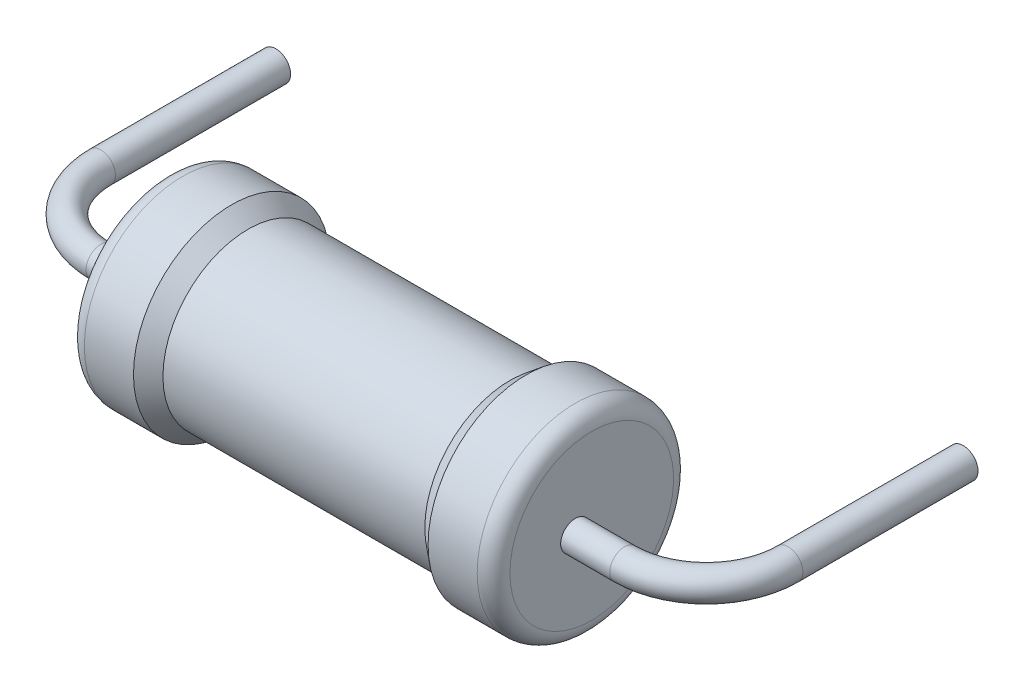
from build123d import *

# Parameters (mm, degrees)
SKETCH_1_R      = 0.45
FILLET_1_R      = 0.5
SKETCH_4_R      = 0.45
EXTRUDE_1_DEPTH = 4


with BuildPart() as part:
    # Эскиз2 → Повернуть1 (revolve)
    with BuildSketch(Plane.XY.offset(3.35), mode=Mode.PRIVATE) as revolve_1_sk:
        Polygon((4, 0), (17, 0), (17, 3), (15, 3), (14.5, 2.6), (6.5, 2.6), (6, 3), (4, 3), align=None)
    revolve(revolve_1_sk.sketch.rotate(Axis((0, 0, 3.35), (1, 0, 0)), 90), axis=Axis((0, 0, 3.35), (1, 0, 0)))

    # По траектории1: sweep along a path in Эскиз3
    with BuildLine(Plane(origin=(0, 0, 0), x_dir=(1, 0, 0), z_dir=(0, 1, 0))) as sweep_1_path:
        Line((20.5, 0), (20.5, -1.35))
        ThreePointArc((20.5, -1.35), (19.914213562, -2.764213562), (18.5, -3.35))
        Line((18.5, -3.35), (2.5, -3.35))
        ThreePointArc((2.5, -3.35), (1.085786438, -2.764213562), (0.5, -1.35))
        Line((0.5, -1.35), (0.5, 0))
    # Эскиз1 → По траектории1 (sweep)
    with BuildSketch(Plane.XY):
        Circle(SKETCH_1_R)
    sweep(path=sweep_1_path.line)

    # Скругление1
    fillet_1_edges = [part.edges().sort_by_distance(p)[0] for p in [
        (17, 0, 0.35),
        (4, 0, 0.35),
    ]]
    fillet(fillet_1_edges, radius=FILLET_1_R)

    # Эскиз4 → Вытянуть1 (add)
    with BuildSketch(Plane(origin=(0, 0, 0), x_dir=(-1, 0, 0), z_dir=(0, 0, -1))):
        Circle(SKETCH_4_R)
        with Locations((-21, 0)):
            Circle(SKETCH_4_R)
    extrude(amount=EXTRUDE_1_DEPTH)


solid = part.part
